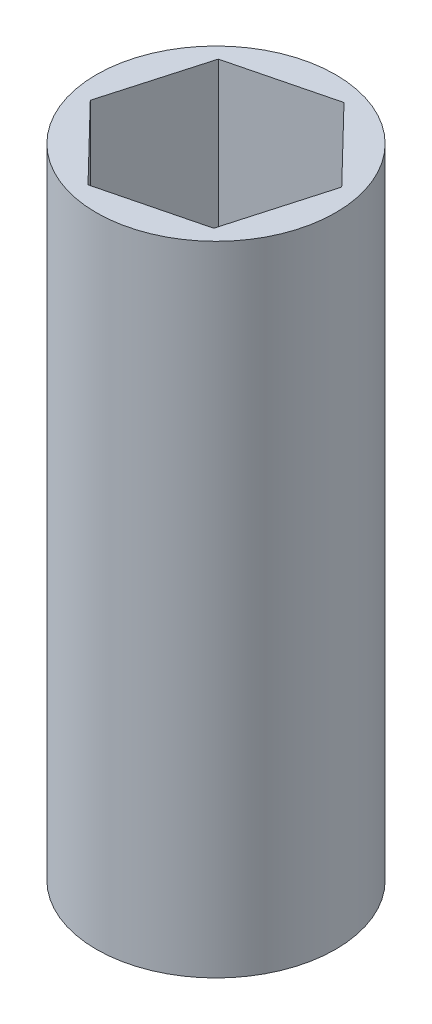
from build123d import *

# Parameters (mm, degrees)
SKETCH1_R           = 6.35
BOSS_EXTRUDE1_DEPTH = 33.866666667


with BuildPart() as part:
    # Sketch1 → Boss-Extrude1 (new body)
    with BuildSketch(Plane(origin=(0, 0, 0), x_dir=(1, 0, 0), z_dir=(0, 1, 0))):
        with Locations(Location((0, 0, 0), (0, 0, 270))):
            Circle(SKETCH1_R)
        Polygon((1.505663563, 5.289125848), (-3.827685567, 3.948505819), (-5.333349129, -1.340620029), (-1.505663563, -5.289125848), (3.827685567, -3.948505819), (5.333349129, 1.340620029), align=None, mode=Mode.SUBTRACT)
    extrude(amount=BOSS_EXTRUDE1_DEPTH)


solid = part.part
